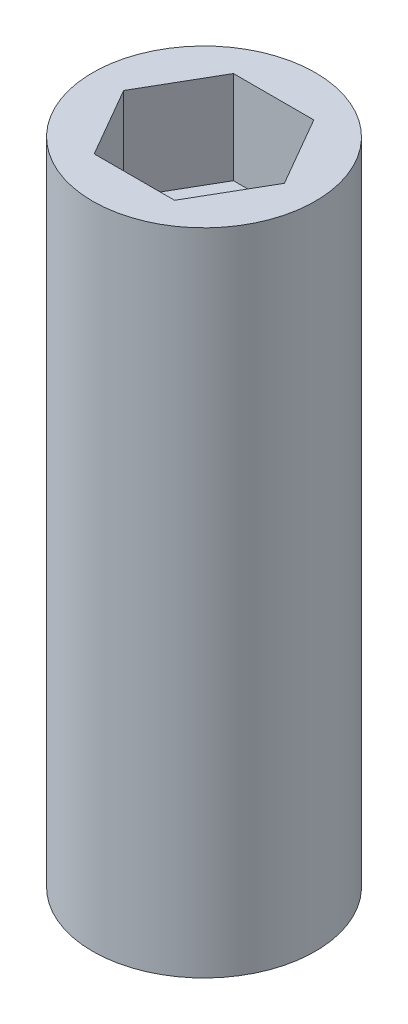
from build123d import *

# Parameters (mm, degrees)
SKETCH1_R           = 1.2
BOSS_EXTRUDE1_DEPTH = 7
CUT_EXTRUDE1_DEPTH  = 1


with BuildPart() as part:
    # Sketch1 → Boss-Extrude1 (new body)
    with BuildSketch(Plane(origin=(0, 0, 0), x_dir=(1, 0, 0), z_dir=(0, 1, 0))):
        with Locations(Location((0, 0, 0), (0, 0, 270))):
            Circle(SKETCH1_R)
    extrude(amount=BOSS_EXTRUDE1_DEPTH)

    # Sketch2 → Cut-Extrude1 (cut)
    with BuildSketch(Plane(origin=(0, 7, 0), x_dir=(1, 0, 0), z_dir=(0, 1, 0))):
        Polygon((0.866025404, 0), (0.433012702, 0.75), (-0.433012702, 0.75), (-0.866025404, 0), (-0.433012702, -0.75), (0.433012702, -0.75), align=None)
    extrude(amount=-CUT_EXTRUDE1_DEPTH, mode=Mode.SUBTRACT)


solid = part.part
